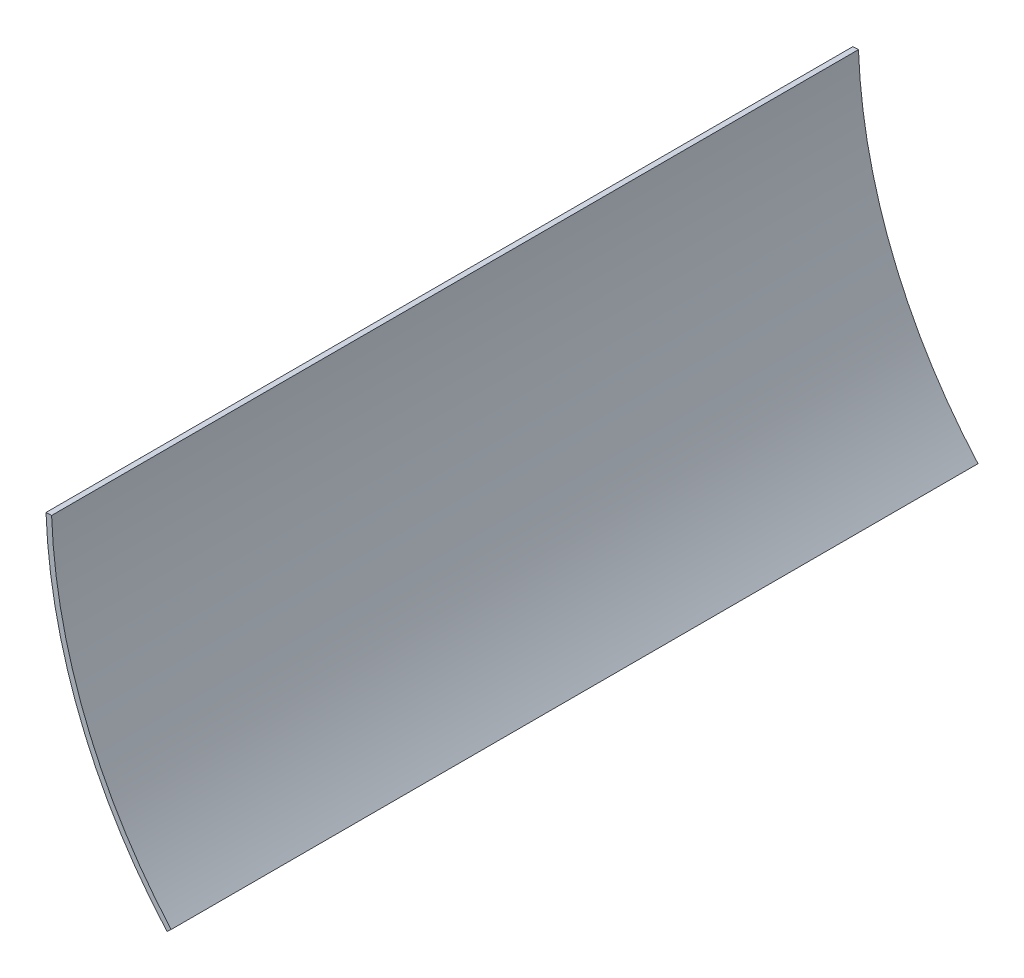
from build123d import *

# Parameters (mm, degrees)
EXTRUDE_THIN1_DEPTH      = 342.9
BOSS_EXTRUDE3_REACH      = 442.49
BOSS_EXTRUDE3_END_RADIUS = 411.1625
SKETCH8_R                = 19.05


with BuildPart() as part:
    # Sketch1 → Extrude-Thin1 (new, symmetric)
    with BuildSketch(Plane.XY):
        with BuildLine():
            ThreePointArc((0, 0), (28.7854342, -135.80582632), (101.6, -254))
            Line((101.6, -254), (98.031425453, -257.153836069))
            ThreePointArc((98.031425453, -257.153836069), (24.36356396, -137.574574416), (-4.759199547, -0.177273569))
            Line((-4.759199547, -0.177273569), (0, 0))
        make_face()
    extrude(amount=EXTRUDE_THIN1_DEPTH, both=True)

    # Boss-Extrude3: up to this cylinder (the profile starts outside it)
    boss_extrude3_end = Plane(origin=(406.118361376, 15.12734455, 0), z_dir=(0, 0, -1)) * Cylinder(BOSS_EXTRUDE3_END_RADIUS, 2089.305, mode=Mode.PRIVATE)
    # Sketch8 → Boss-Extrude3 (add, up to the surface)
    with BuildSketch(Plane(origin=(0, -257.153836069, 0), x_dir=(1, 0, 0), z_dir=(0, 1, 0)), mode=Mode.PRIVATE) as boss_extrude3_sk1:
        with Locations((14.290800453, -190.5)):
            Circle(SKETCH8_R)
    boss_extrude3_tool1 = extrude(boss_extrude3_sk1.sketch, amount=BOSS_EXTRUDE3_REACH, mode=Mode.PRIVATE) - boss_extrude3_end
    add(boss_extrude3_tool1.solids().sort_by_distance((14.2908, -257.153836, 190.5))[0])
    # Sketch8 → Boss-Extrude3 (add, up to the surface)
    with BuildSketch(Plane(origin=(0, -257.153836069, 0), x_dir=(1, 0, 0), z_dir=(0, 1, 0)), mode=Mode.PRIVATE) as boss_extrude3_sk2:
        with Locations((14.290800453, 190.5)):
            Circle(SKETCH8_R)
    boss_extrude3_tool2 = extrude(boss_extrude3_sk2.sketch, amount=BOSS_EXTRUDE3_REACH, mode=Mode.PRIVATE) - boss_extrude3_end
    add(boss_extrude3_tool2.solids().sort_by_distance((14.2908, -257.153836, -190.5))[0])


solid = part.part
